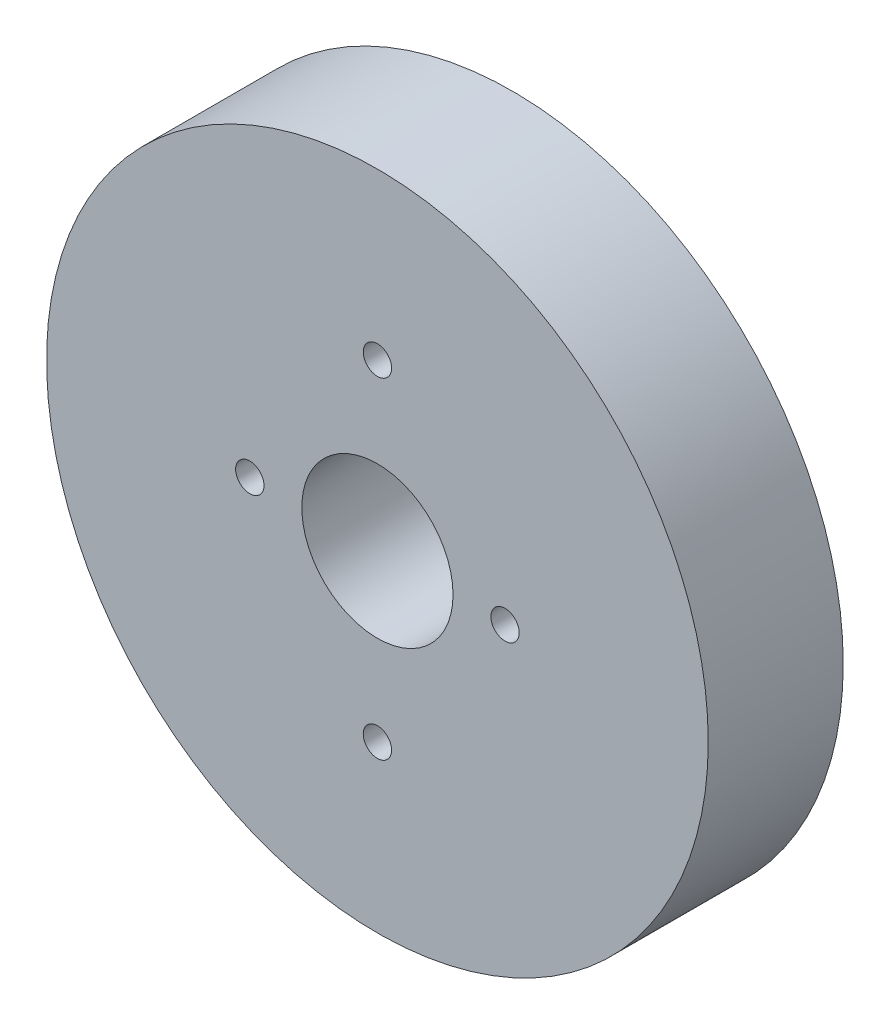
from build123d import *

# Parameters (mm, degrees)
SKETCH_1_R      = 17.5
SKETCH_1_R_2    = 4
SKETCH_1_R_3    = 0.75
EXTRUDE_1_DEPTH = 7.14


with BuildPart() as part:
    # 草图1 → 凸台-拉伸1 (new body)
    with BuildSketch(Plane.XY):
        Circle(SKETCH_1_R)
        Circle(SKETCH_1_R_2, mode=Mode.SUBTRACT)
        with Locations((6.75, 0)):
            Circle(SKETCH_1_R_3, mode=Mode.SUBTRACT)
        with Locations((0, 8.75)):
            Circle(SKETCH_1_R_3, mode=Mode.SUBTRACT)
        with Locations(Location((-6.75, 0, 0), (0, 0, 180))):
            Circle(SKETCH_1_R_3, mode=Mode.SUBTRACT)
        with Locations(Location((0, -8.75, 0), (0, 0, 180))):
            Circle(SKETCH_1_R_3, mode=Mode.SUBTRACT)
    extrude(amount=EXTRUDE_1_DEPTH)


solid = part.part
